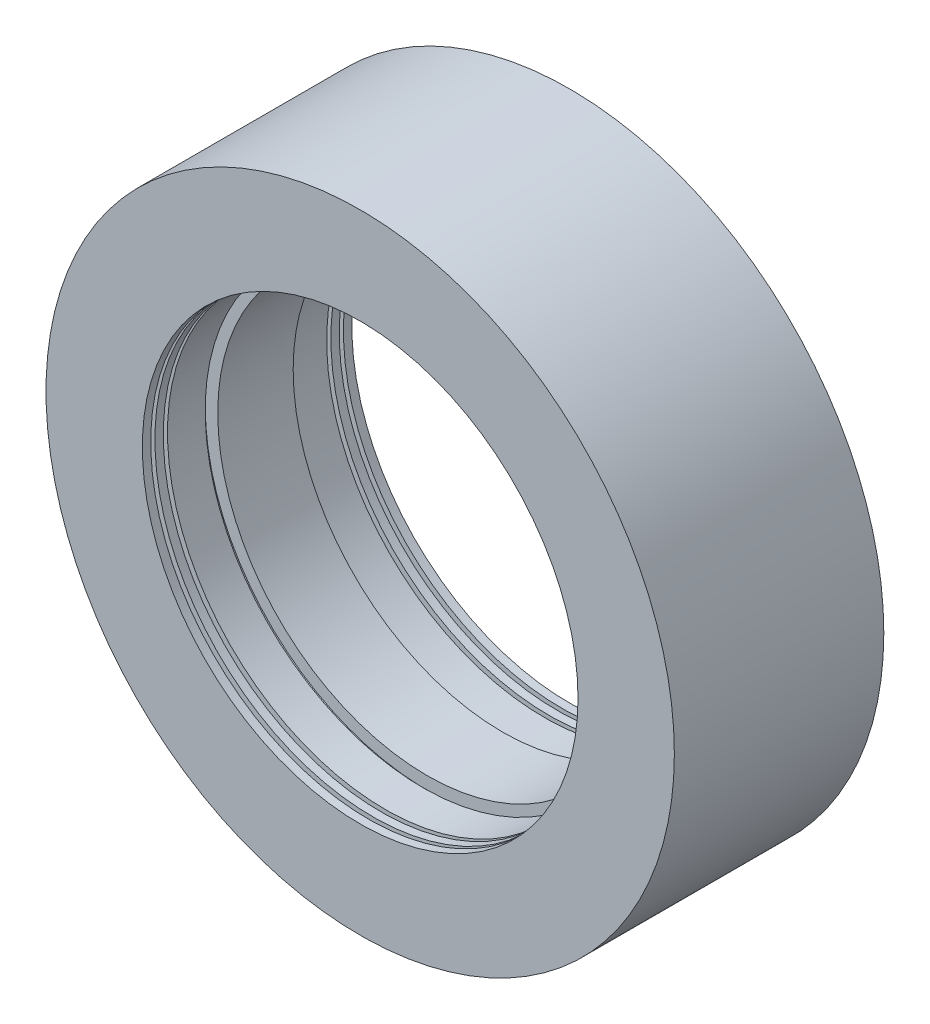
from build123d import *


with BuildPart() as part:
    # Sketch1 → Revolve1 (revolve)
    with BuildSketch(Plane(origin=(0, 0, 0), x_dir=(0, 0, -1), z_dir=(1, 0, 0)), mode=Mode.PRIVATE) as revolve1_sk:
        Polygon((-142.749573327, 73.502909781), (-92.749573327, 73.502909781), (-92.749573327, 50.502909781), (-94.749573327, 50.502909781), (-94.749573327, 52.502909781), (-95.749573327, 52.502909781), (-95.749573327, 50.502909781), (-97.749573327, 50.502909781), (-97.749573327, 52.502909781), (-98.749573327, 52.502909781), (-98.749573327, 50.502909781), (-107.749573327, 50.502909781), (-107.749573327, 51.502909781), (-108.749573327, 51.502909781), (-108.749573327, 48.502909781), (-126.749573327, 48.502909781), (-126.749573327, 51.502909781), (-127.749573327, 51.502909781), (-127.749573327, 50.502909781), (-136.749573327, 50.502909781), (-136.749573327, 52.502909781), (-137.749573327, 52.502909781), (-137.749573327, 50.502909781), (-139.749573327, 50.502909781), (-139.749573327, 52.502909781), (-140.749573327, 52.502909781), (-140.749573327, 50.502909781), (-142.749573327, 50.502909781), align=None)
    revolve(revolve1_sk.sketch.rotate(Axis((0, -1.497090219, 168.192153132), (0, 0, -1)), 90), axis=Axis((0, -1.497090219, 168.192153132), (0, 0, -1)))


solid = part.part
